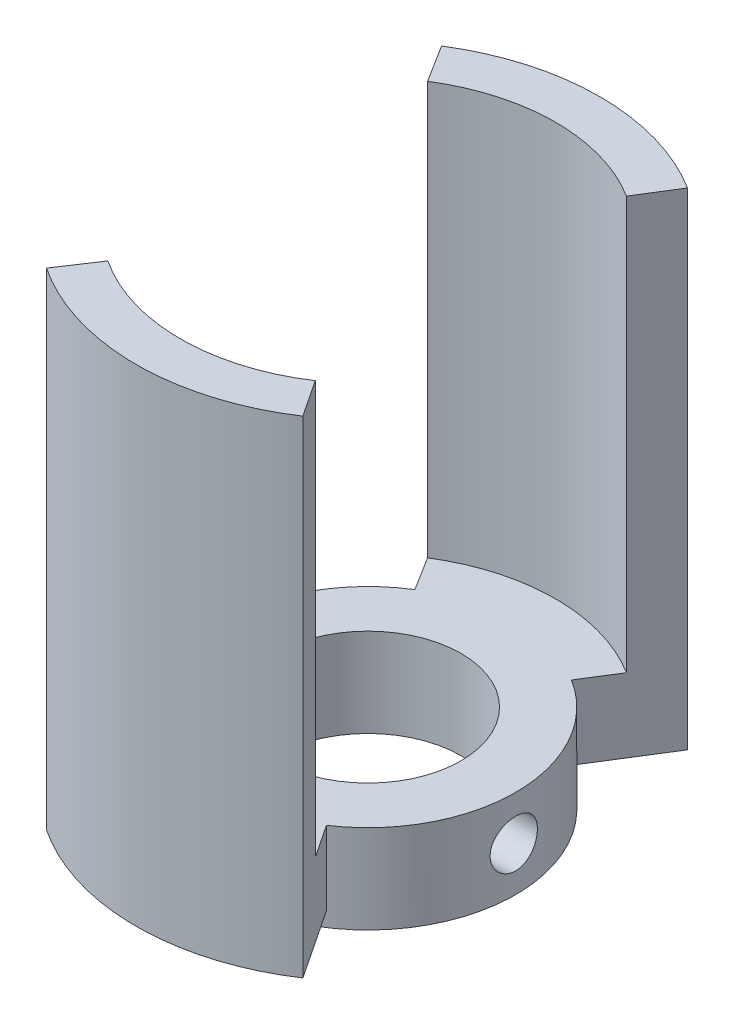
from build123d import *

# Parameters (mm, degrees)
SKETCH1_W                  = 5
SKETCH1_H                  = 3
SKETCH2_R                  = 3.15
CUT_EXTRUDE1_DEPTH         = 8.681145748
M2X0_4_TAPPED_HOLE2_REACH  = 13.576
M2X0_4_TAPPED_HOLE2_BORE_R = 0.8
BOSS_EXTRUDE1_DEPTH        = 13.97
BOSS_EXTRUDE1_2_DEPTH      = 13.97
BOSS_EXTRUDE2_DEPTH        = 2.5


with BuildPart() as part:
    # Sketch1 → Revolve1 (revolve)
    with BuildSketch(Plane.XY, mode=Mode.PRIVATE) as revolve1_sk:
        with Locations((-2.5, -1.5)):
            Rectangle(SKETCH1_W, SKETCH1_H)
    revolve(revolve1_sk.sketch.rotate(Axis((0, 5.888182105, 0), (0, -1, 0)), 270), axis=Axis((0, 5.888182105, 0), (0, -1, 0)))

    # Sketch2 → Cut-Extrude1 (cut, through all)
    with BuildSketch(Plane(origin=(0, 0, 0), x_dir=(1, 0, 0), z_dir=(0, 1, 0))):
        with Locations(Location((0, 0, 0), (0, 0, 270))):
            Circle(SKETCH2_R)
    extrude(amount=-CUT_EXTRUDE1_DEPTH, mode=Mode.SUBTRACT)

    # M2x0.4 Tapped Hole2 bore → M2x0.4 Tapped Hole2 (cut, up to next)
    with BuildSketch(Plane(origin=(5, 0, 0), x_dir=(0, 0, -1), z_dir=(1, 0, 0)), mode=Mode.PRIVATE) as m2x0_4_tapped_hole2_sk1:
        with Locations((0, -1.5)):
            Circle(M2X0_4_TAPPED_HOLE2_BORE_R)
    m2x0_4_tapped_hole2_tool1 = extrude(m2x0_4_tapped_hole2_sk1.sketch, amount=-M2X0_4_TAPPED_HOLE2_REACH, mode=Mode.PRIVATE) & part.part
    add(m2x0_4_tapped_hole2_tool1.solids().sort_by_distance((5, -1.5, 0))[0], mode=Mode.SUBTRACT)



with BuildPart() as body_2:
    # Sketch9 → Boss-Extrude1 (new body)
    with BuildSketch(Plane(origin=(0, 0, 0), x_dir=(1, 0, 0), z_dir=(0, 1, 0))):
        with BuildLine():
            Line((-3.366324533, 5.384269602), (-4.161519304, 6.656144311))
            ThreePointArc((-4.161519304, 6.656144311), (0, 7.85), (4.161519304, 6.656144311))
            Line((4.161519304, 6.656144311), (3.366324533, 5.384269602))
            ThreePointArc((3.366324533, 5.384269602), (0, 6.35), (-3.366324533, 5.384269602))
        make_face()
    extrude(amount=BOSS_EXTRUDE1_DEPTH)


with BuildPart() as body_3:
    # Sketch9 → Boss-Extrude1 2 (new body)
    with BuildSketch(Plane(origin=(0, 0, 0), x_dir=(1, 0, 0), z_dir=(0, 1, 0))):
        with BuildLine():
            Line((3.509629139, -5.291975369), (4.338675392, -6.542048291))
            ThreePointArc((4.338675392, -6.542048291), (0, -7.85), (-4.338675392, -6.542048291))
            Line((-4.338675392, -6.542048291), (-3.509629139, -5.291975369))
            ThreePointArc((-3.509629139, -5.291975369), (0, -6.35), (3.509629139, -5.291975369))
        make_face()
    extrude(amount=BOSS_EXTRUDE1_2_DEPTH)


with BuildPart() as part_1:
    add(part.part)

    add(body_2.part)  # Boss-Extrude2 merges body 2

    add(body_3.part)  # Boss-Extrude2 merges body 3
    # Sketch11 → Boss-Extrude2 (add)
    with BuildSketch(Plane.XZ):
        with BuildLine():
            Line((4.161519304, -6.656144311), (2.650649238, -4.239582363))
            ThreePointArc((2.650649238, -4.239582363), (0, -5), (-2.650649238, -4.239582363))
            Line((-2.650649238, -4.239582363), (-4.161519304, -6.656144311))
            ThreePointArc((-4.161519304, -6.656144311), (0, -7.85), (4.161519304, -6.656144311))
        make_face()
        with BuildLine():
            Line((-4.338675392, 6.542048291), (-2.763487511, 4.166909739))
            ThreePointArc((-2.763487511, 4.166909739), (0, 5), (2.763487511, 4.166909739))
            Line((2.763487511, 4.166909739), (4.338675392, 6.542048291))
            ThreePointArc((4.338675392, 6.542048291), (0, 7.85), (-4.338675392, 6.542048291))
        make_face()
    extrude(amount=BOSS_EXTRUDE2_DEPTH)


solid = part_1.part
